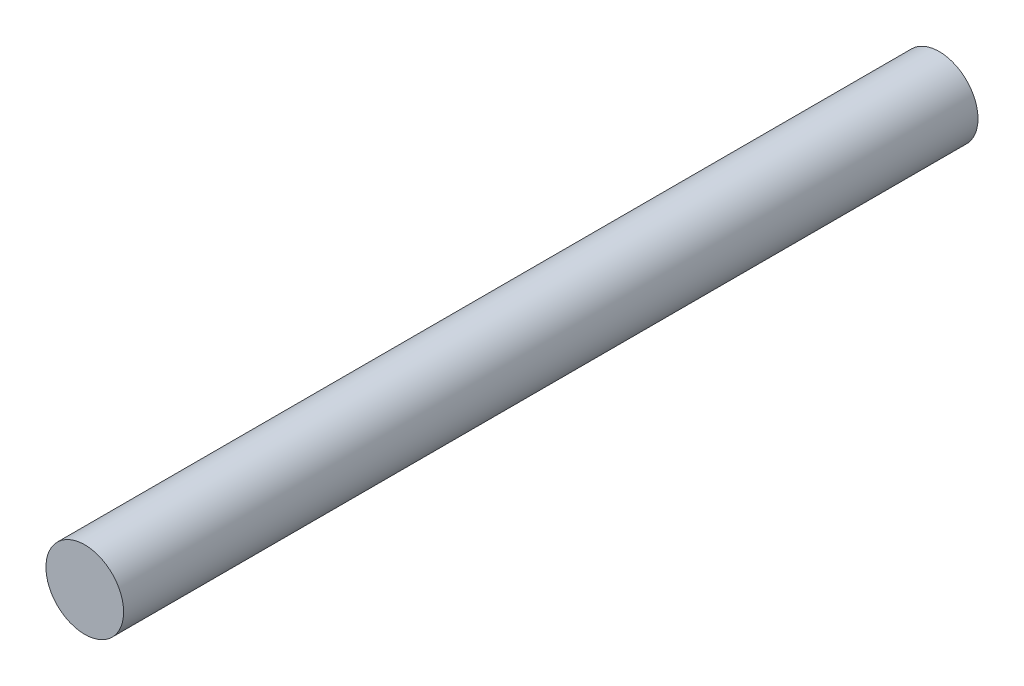
from build123d import *

# Parameters (mm, degrees)
SKETCH1_R           = 2.5
BOSS_EXTRUDE1_DEPTH = 55


with BuildPart() as part:
    # Sketch1 → Boss-Extrude1 (new body)
    with BuildSketch(Plane.XY):
        Circle(SKETCH1_R)
    extrude(amount=BOSS_EXTRUDE1_DEPTH)


solid = part.part
